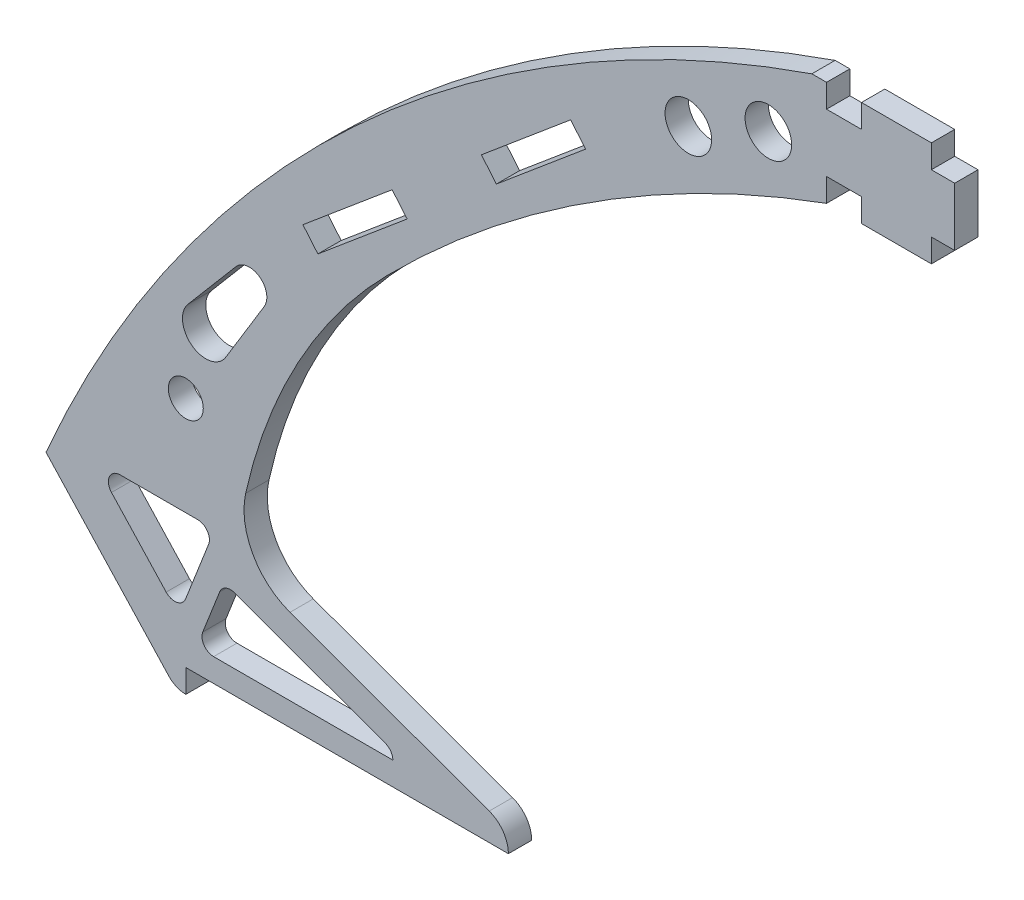
from build123d import *

# Parameters (mm, degrees)
SKETCH1_R           = 1.5
SKETCH1_R_2         = 2
BOSS_EXTRUDE1_DEPTH = 2


with BuildPart() as part:
    # Sketch1 → Boss-Extrude1 (new body)
    with BuildSketch(Plane.XY):
        with BuildLine():
            Line((-62.309511, 0), (-90, 0))
            Line((-90, 0), (-90, -2))
            ThreePointArc((-90, -2), (-90.800086058, -1.832992717), (-91.466551917, -1.3598623))
            Line((-91.466551917, -1.3598623), (-102, 10))
            ThreePointArc((-102, 10), (-75.5606337, 47.428438735), (-36.262928729, 71))
            Line((-36.262928729, 71), (-35, 71))
            Line((-35, 71), (-35, 69))
            Line((-35, 69), (-32, 69))
            Line((-32, 69), (-32, 71))
            Line((-32, 71), (-26, 71))
            Line((-26, 71), (-26, 69))
            Line((-26, 69), (-24, 69))
            Line((-24, 69), (-24, 64))
            Line((-24, 64), (-26, 64))
            Line((-26, 64), (-26, 62))
            Line((-26, 62), (-32, 62))
            Line((-32, 62), (-32, 64))
            Line((-32, 64), (-35, 64))
            Line((-35, 64), (-35, 62))
            ThreePointArc((-35, 62), (-55.195926155, 51.990753781), (-72.706011232, 37.797186092))
            ThreePointArc((-72.706011232, 37.797186092), (-80.350726752, 27.513864966), (-84.859723335, 15.519811498))
            ThreePointArc((-84.859723335, 15.519811498), (-84.266660534, 11.330126172), (-81.056134593, 8.573731826))
            Line((-81.056134593, 8.573731826), (-63.954460642, 2.349231552))
            ThreePointArc((-63.954460642, 2.349231552), (-62.76163089, 1.433941091), (-62.309511, 0))
        make_face()
        with Locations((-90, 20)):
            Circle(SKETCH1_R, mode=Mode.SUBTRACT)
        with Locations((-46.864489858, 61.785493015)):
            Circle(SKETCH1_R_2, mode=Mode.SUBTRACT)
        with Locations((-39.993861134, 64.851566266)):
            Circle(SKETCH1_R_2, mode=Mode.SUBTRACT)
        with BuildLine():
            Line((-89.810992251, 27.099684807), (-85.686951519, 31.9596162))
            ThreePointArc((-85.686951519, 31.9596162), (-83.665127869, 32.205193808), (-83.262186445, 30.208767641))
            Line((-83.262186445, 30.208767641), (-86.577972152, 24.765220061))
            ThreePointArc((-86.577972152, 24.765220061), (-89.456863792, 24.184169423), (-89.810992251, 27.099684807))
        make_face(mode=Mode.SUBTRACT)
        with BuildLine():
            Line((-72.886250096, 2.939692621), (-85.819268287, 7.646926281))
            ThreePointArc((-85.819268287, 7.646926281), (-86.572995727, 7.618549798), (-87.092498654, 7.071716197))
            Line((-87.092498654, 7.071716197), (-88.543537199, 3.364482536))
            ThreePointArc((-88.543537199, 3.364482536), (-88.438305951, 2.436299076), (-87.612326975, 2))
            Line((-87.612326975, 2), (-72.228270239, 2))
            ThreePointArc((-72.228270239, 2), (-72.409118195, 2.573576436), (-72.886250096, 2.939692621))
        make_face(mode=Mode.SUBTRACT)
        with BuildLine():
            Line((-95.644910389, 11.5), (-88.972257251, 11.5))
            ThreePointArc((-88.972257251, 11.5), (-88.146278275, 11.063700924), (-88.041047027, 10.135517464))
            Line((-88.041047027, 10.135517464), (-90.021639474, 5.075335561))
            ThreePointArc((-90.021639474, 5.075335561), (-90.766646985, 4.457306749), (-91.686125656, 4.759886947))
            Line((-91.686125656, 4.759886947), (-96.378186348, 9.82006885))
            ThreePointArc((-96.378186348, 9.82006885), (-96.561406748, 10.900043029), (-95.644910389, 11.5))
        make_face(mode=Mode.SUBTRACT)
        Polygon((-78.661971859, 36.409830161), (-71.001527428, 42.837706258), (-72.287102647, 44.369795144), (-79.947547078, 37.941919047), align=None, mode=Mode.SUBTRACT)
        Polygon((-63.341082997, 49.265582354), (-64.626658216, 50.797671241), (-56.966213785, 57.225547337), (-55.680638565, 55.693458451), align=None, mode=Mode.SUBTRACT)
    extrude(amount=BOSS_EXTRUDE1_DEPTH)


solid = part.part
